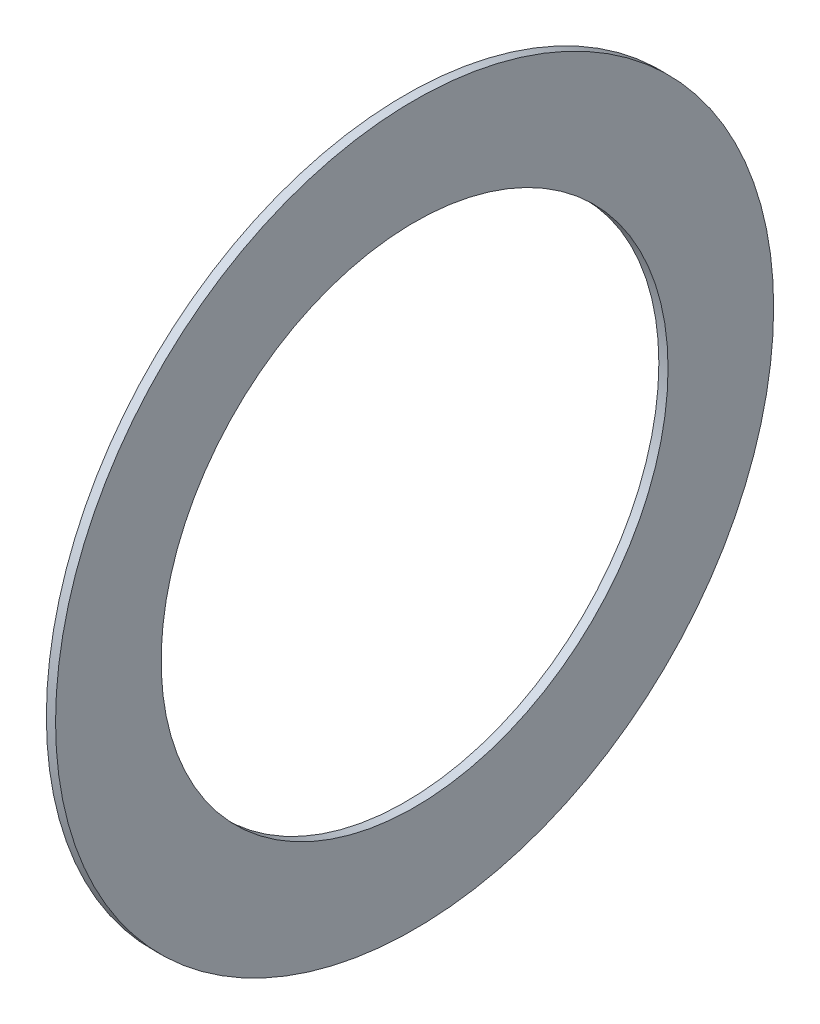
from build123d import *

# Parameters (mm, degrees)
BOSS_EXTRUDE1_DEPTH      = 0.5
BOSS_EXTRUDE1_DEPTH_BACK = 0.5
SKETCH3_R                = 39
SKETCH3_R_2              = 27.53


with BuildPart() as part:
    # Sketch3 → Boss-Extrude1 (new, two sides: drawn at the far end of the back side and taken through both)
    with BuildSketch(Plane(origin=(0, 0, 0), x_dir=(0, 0, -1), z_dir=(1, 0, 0)).offset(-BOSS_EXTRUDE1_DEPTH_BACK)):
        Circle(SKETCH3_R)
        Circle(SKETCH3_R_2, mode=Mode.SUBTRACT)
    extrude(amount=BOSS_EXTRUDE1_DEPTH + BOSS_EXTRUDE1_DEPTH_BACK)


solid = part.part
